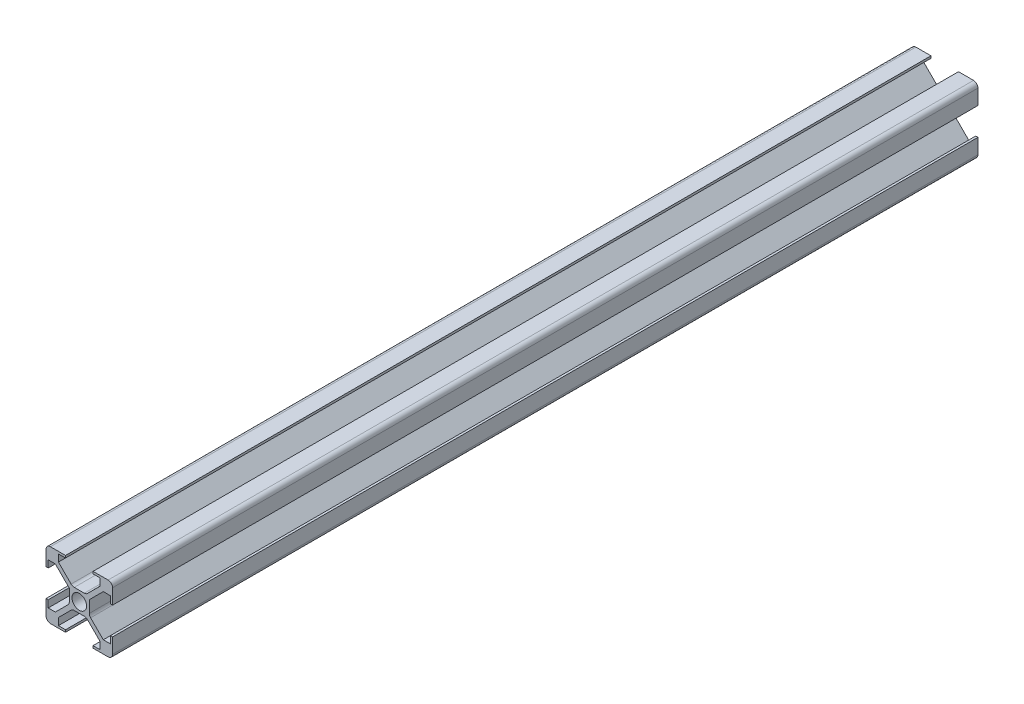
from build123d import *

# Parameters (mm, degrees)
SKETCH_1_R      = 1.65
EXTRUDE_1_DEPTH = 195
FILLET_1_R      = 1


with BuildPart() as part:
    # 草图1 → 凸台-拉伸1 (new body)
    with BuildSketch(Plane.XY):
        Polygon((7.5, 7.5), (7.5, 3.1), (7, 3.1), (7, 4.7), (5.407106781, 4.7), (2.254923973, 1.547817192), (2.254923973, 0), (2.254923973, -1.547817192), (5.407106781, -4.7), (7, -4.7), (7, -3.1), (7.5, -3.1), (7.5, -7.5), (3.1, -7.5), (3.1, -7), (4.7, -7), (4.7, -5.407106781), (1.547817192, -2.254923973), (0, -2.254923973), (-1.547817192, -2.254923973), (-4.7, -5.407106781), (-4.7, -7), (-3.1, -7), (-3.1, -7.5), (-7.5, -7.5), (-7.5, -3.1), (-7, -3.1), (-7, -4.7), (-5.407106781, -4.7), (-2.254923973, -1.547817192), (-2.254923973, 0), (-2.254923973, 1.547817192), (-5.407106781, 4.7), (-7, 4.7), (-7, 3.1), (-7.5, 3.1), (-7.5, 7.5), (-3.1, 7.5), (-3.1, 7), (-4.7, 7), (-4.7, 5.407106781), (-1.547817192, 2.254923973), (0, 2.254923973), (1.547817192, 2.254923973), (4.7, 5.407106781), (4.7, 7), (3.1, 7), (3.1, 7.5), align=None)
        Circle(SKETCH_1_R, mode=Mode.SUBTRACT)
    extrude(amount=EXTRUDE_1_DEPTH)

    # 圆角1
    fillet_1_edges = [part.edges().sort_by_distance(p)[0] for p in [
        (7.5, 7.5, 97.5),
        (2.254923973, -1.547817192, 97.5),
        (7.5, -7.5, 97.5),
        (1.547817192, -2.254923973, 97.5),
        (-1.547817192, -2.254923973, 97.5),
        (-7.5, -7.5, 97.5),
        (-2.254923973, -1.547817192, 97.5),
        (-7.5, 7.5, 97.5),
        (-1.547817192, 2.254923973, 97.5),
        (1.547817192, 2.254923973, 97.5),
    ]]
    fillet(fillet_1_edges, radius=FILLET_1_R)


solid = part.part
